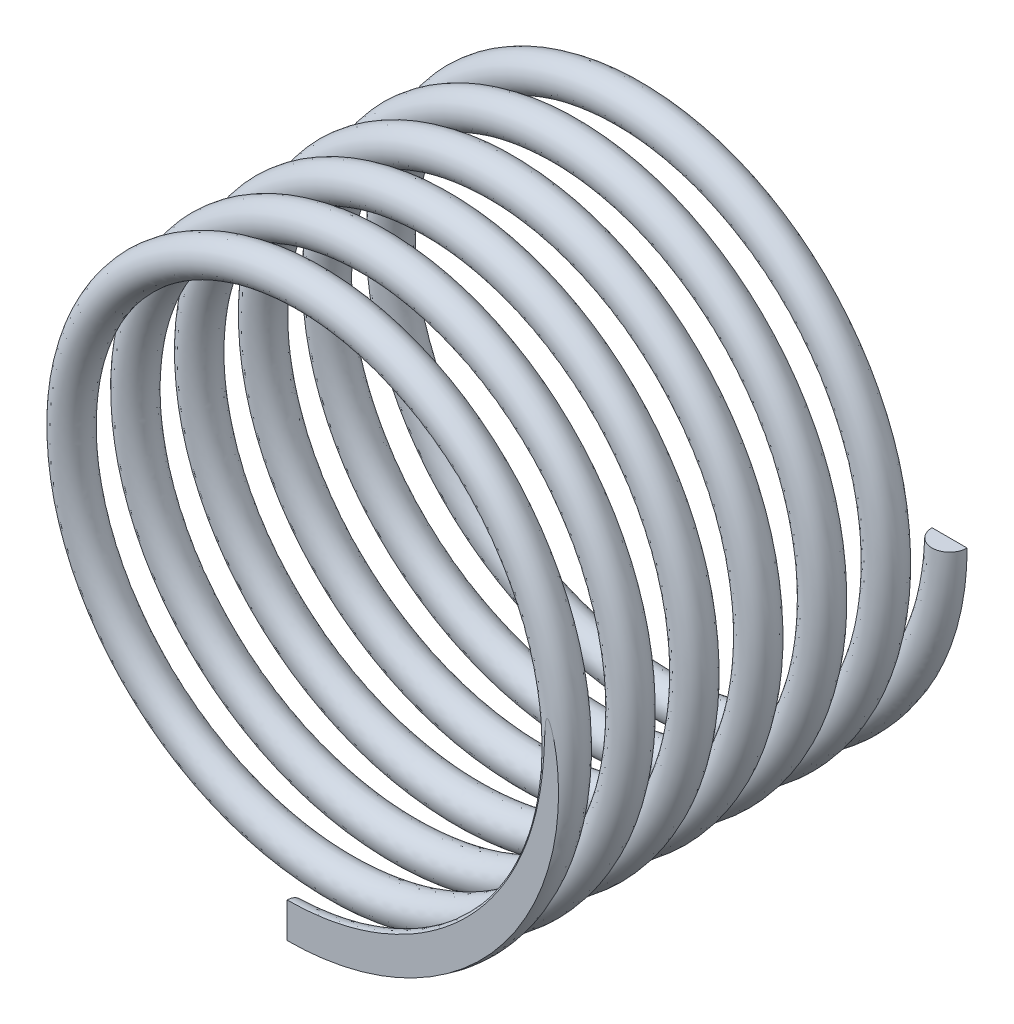
from build123d import *

# Parameters (mm, degrees)
SWEEP1_PITCH            = 4
SWEEP1_HEIGHT           = 25
SWEEP1_RADIUS           = 16.5
SKETCH2_R               = 1.1
CUT_EXTRUDE1_DEPTH      = 37.065647703
CUT_EXTRUDE1_DEPTH_BACK = 37.065647703
SKETCH3_W               = 43.987406561
SKETCH3_H               = 3.768960992
SKETCH3_W_2             = 42.086994639
SKETCH3_H_2             = 3.071981074


with BuildPart() as part:
    # Sweep1: sweep along a helix
    with BuildLine() as sweep1_path:
        Helix(SWEEP1_PITCH, SWEEP1_HEIGHT, SWEEP1_RADIUS, center=(0, 0, 0), direction=(0, 0, 1), lefthand=True)
    # Sketch2 → Sweep1 (sweep)
    with BuildSketch(Plane(origin=(0, 0, 0), x_dir=(1, 0, 0), z_dir=(0, 1, 0))):
        with Locations((16.5, 0)):
            Circle(SKETCH2_R)
    sweep(path=sweep1_path.line, is_frenet=True)

    # Sketch3 → Cut-Extrude1 (cut, two sides: drawn at the far end of the back side and taken through both)
    with BuildSketch(Plane(origin=(0, 0, 0), x_dir=(1, 0, 0), z_dir=(0, 1, 0)).offset(-CUT_EXTRUDE1_DEPTH_BACK)):
        with Locations((1.801483593, 1.884480496)):
            Rectangle(SKETCH3_W, SKETCH3_H)
        with Locations((1.171396328, -26.535990537)):
            Rectangle(SKETCH3_W_2, SKETCH3_H_2)
    extrude(amount=CUT_EXTRUDE1_DEPTH + CUT_EXTRUDE1_DEPTH_BACK, mode=Mode.SUBTRACT)


solid = part.part
